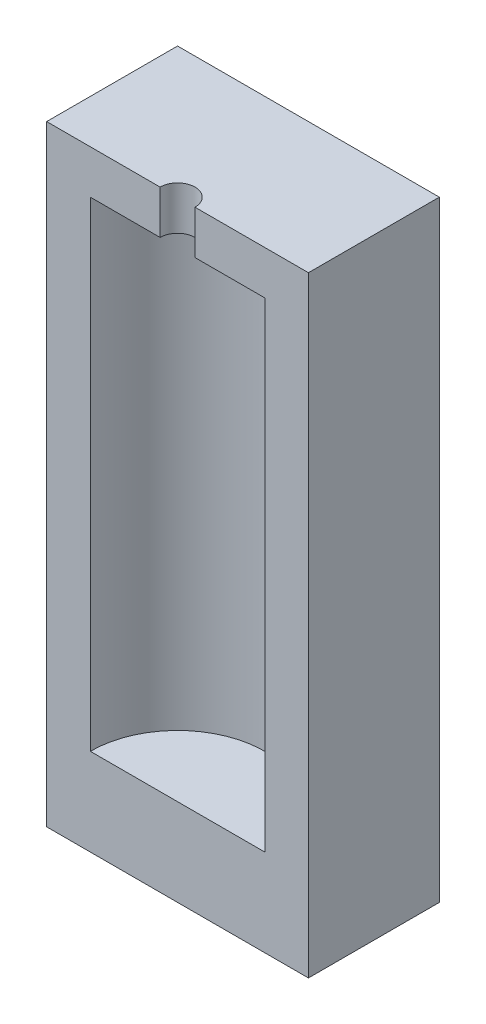
from build123d import *

# Parameters (mm, degrees)
SKETCH1_W           = 30
SKETCH1_H           = 15
BOSS_EXTRUDE1_DEPTH = 70
SKETCH2_R           = 2
CUT_EXTRUDE1_DEPTH  = 5
CUT_EXTRUDE2_START  = -5
SKETCH3_R           = 10
CUT_EXTRUDE2_DEPTH  = 55


with BuildPart() as part:
    # Sketch1 → Boss-Extrude1 (new body)
    with BuildSketch(Plane(origin=(0, 0, 0), x_dir=(1, 0, 0), z_dir=(0, 1, 0))):
        Rectangle(SKETCH1_W, SKETCH1_H)
    extrude(amount=BOSS_EXTRUDE1_DEPTH)

    # Sketch2 → Cut-Extrude1 (cut)
    with BuildSketch(Plane(origin=(0, 70, 0), x_dir=(1, 0, 0), z_dir=(0, 1, 0))):
        with Locations((0, -7.5)):
            Circle(SKETCH2_R)
    extrude(amount=-CUT_EXTRUDE1_DEPTH, mode=Mode.SUBTRACT)

    # Sketch3 → Cut-Extrude2 (cut)
    with BuildSketch(Plane(origin=(0, 70, 0), x_dir=(1, 0, 0), z_dir=(0, 1, 0)).offset(CUT_EXTRUDE2_START)):
        with Locations((0, -7.5)):
            Circle(SKETCH3_R)
    extrude(amount=-CUT_EXTRUDE2_DEPTH, mode=Mode.SUBTRACT)


solid = part.part
